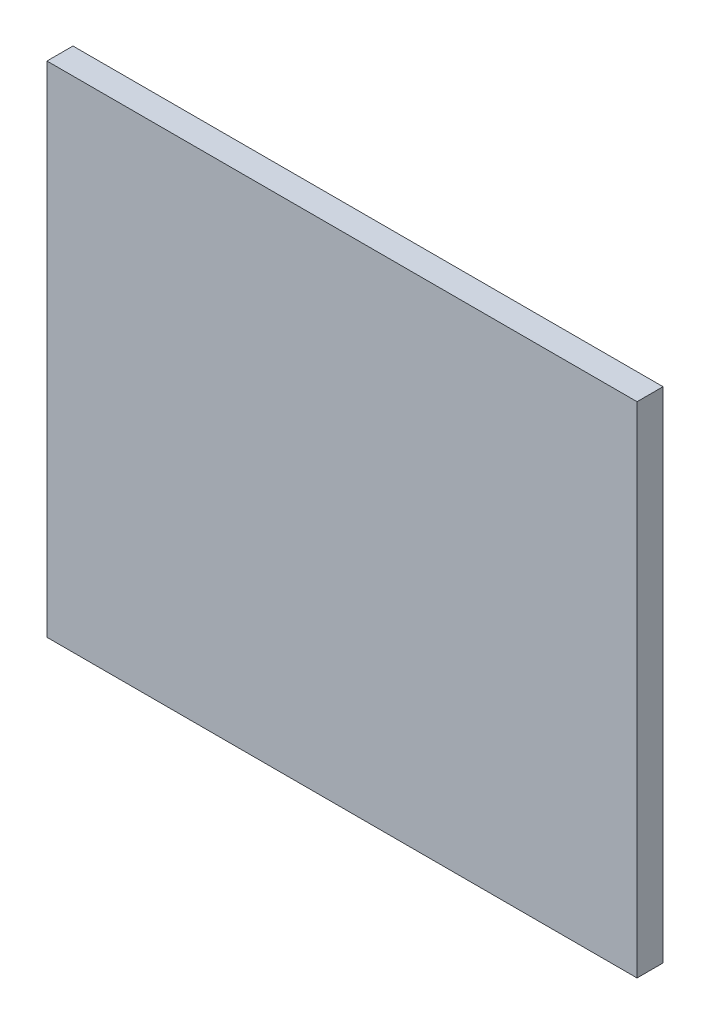
from build123d import *

# Parameters (mm, degrees)
ESBO_O5_W       = 227
ESBO_O5_H       = 192
EXTRUS_O1_DEPTH = 10


with BuildPart() as part:
    # Esboço5 → Extrusão1 (new body)
    with BuildSketch(Plane.XY):
        with Locations((26.598292528, 64.073010485)):
            Rectangle(ESBO_O5_W, ESBO_O5_H)
    extrude(amount=-EXTRUS_O1_DEPTH)


solid = part.part
